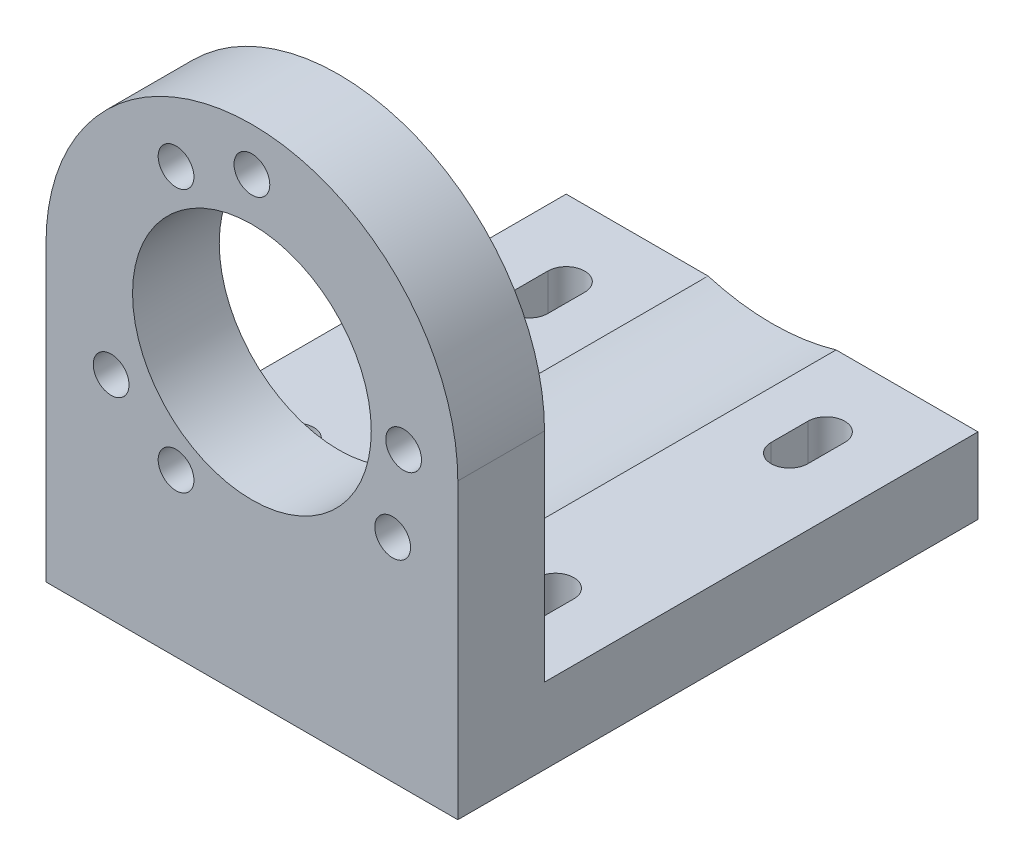
from build123d import *

# Parameters (mm, degrees)
SKETCH1_R                = 11.013886191
BOSS_EXTRUDE1_DEPTH      = 8
BOSS_EXTRUDE2_DEPTH      = 5
BOSS_EXTRUDE2_DEPTH_BACK = 2
SKETCH2_W                = 38
SKETCH2_H                = 48
CUT_EXTRUDE1_DEPTH       = 51
CUT_EXTRUDE2_DEPTH       = 51


with BuildPart() as part:
    # Sketch1 → Boss-Extrude1 (new body)
    with BuildSketch(Plane.XY):
        with BuildLine():
            Line((0, -22.07294906), (-19, -22.07294906))
            Line((-19, -22.07294906), (-19, 0))
            ThreePointArc((-19, 0), (0, 19), (19, 0))
            Line((19, 0), (19, -22.07294906))
            Line((19, -22.07294906), (0, -22.07294906))
        make_face()
        Circle(SKETCH1_R, mode=Mode.SUBTRACT)
        with BuildLine():
            ThreePointArc((-11.340381057, -7.5), (-12.990381057, -5.85), (-14.640381057, -7.5))
            ThreePointArc((-14.640381057, -7.5), (-12.990381057, -9.15), (-11.340381057, -7.5))
        make_face(mode=Mode.SUBTRACT)
        with BuildLine():
            ThreePointArc((-5.35, -12.124355653), (-7, -10.474355653), (-8.65, -12.124355653))
            ThreePointArc((-8.65, -12.124355653), (-7, -13.774355653), (-5.35, -12.124355653))
        make_face(mode=Mode.SUBTRACT)
        with BuildLine():
            ThreePointArc((11.340381057, -7.5), (12.990381057, -9.15), (14.640381057, -7.5))
            ThreePointArc((14.640381057, -7.5), (12.990381057, -5.85), (11.340381057, -7.5))
        make_face(mode=Mode.SUBTRACT)
        with BuildLine():
            ThreePointArc((15.65, 0), (14, 1.65), (12.35, 0))
            ThreePointArc((12.35, 0), (14, -1.65), (15.65, 0))
        make_face(mode=Mode.SUBTRACT)
        with BuildLine():
            ThreePointArc((-1.65, 15), (0, 13.35), (1.65, 15))
            ThreePointArc((1.65, 15), (0, 16.65), (-1.65, 15))
        make_face(mode=Mode.SUBTRACT)
        with BuildLine():
            ThreePointArc((-5.35, 12.124355653), (-7, 13.774355653), (-8.65, 12.124355653))
            ThreePointArc((-8.65, 12.124355653), (-7, 10.474355653), (-5.35, 12.124355653))
        make_face(mode=Mode.SUBTRACT)
    extrude(amount=BOSS_EXTRUDE1_DEPTH)

    # Sketch2 → Boss-Extrude2 (add, two sides: drawn at the far end of the back side and taken through both)
    with BuildSketch(Plane.XZ.offset(22.07294906).offset(-BOSS_EXTRUDE2_DEPTH_BACK)):
        with Locations((0, -16)):
            Rectangle(SKETCH2_W, SKETCH2_H)
    extrude(amount=BOSS_EXTRUDE2_DEPTH + BOSS_EXTRUDE2_DEPTH_BACK)

    # Sketch3 → Cut-Extrude1 (cut)
    with BuildSketch(Plane(origin=(0, 0, 0), x_dir=(-1, 0, 0), z_dir=(0, 0, -1))):
        with BuildLine():
            Line((5.904398983, -20.07294906), (-5.904398983, -20.07294906))
            ThreePointArc((-5.904398983, -20.07294906), (0, -20.923317407), (5.904398983, -20.07294906))
        make_face()
    extrude(amount=CUT_EXTRUDE1_DEPTH, mode=Mode.SUBTRACT)

    # Sketch4 → Cut-Extrude2 (cut)
    with BuildSketch(Plane(origin=(0, -20.07294906, 0), x_dir=(1, 0, 0), z_dir=(0, 1, 0))):
        with BuildLine():
            Line((-13.7, 8.006381215), (-13.7, 4.606381215))
            ThreePointArc((-13.7, 4.606381215), (-12, 2.906381215), (-10.3, 4.606381215))
            Line((-10.3, 4.606381215), (-10.3, 8.006381215))
            ThreePointArc((-10.3, 8.006381215), (-12, 9.706381215), (-13.7, 8.006381215))
        make_face()
        with BuildLine():
            Line((-13.7, 33.006381215), (-13.7, 29.606381215))
            ThreePointArc((-13.7, 29.606381215), (-12, 27.906381215), (-10.3, 29.606381215))
            Line((-10.3, 29.606381215), (-10.3, 33.006381215))
            ThreePointArc((-10.3, 33.006381215), (-12, 34.706381215), (-13.7, 33.006381215))
        make_face()
        with BuildLine():
            Line((13.7, 33.006381215), (13.7, 29.606381215))
            ThreePointArc((13.7, 29.606381215), (12, 27.906381215), (10.3, 29.606381215))
            Line((10.3, 29.606381215), (10.3, 33.006381215))
            ThreePointArc((10.3, 33.006381215), (12, 34.706381215), (13.7, 33.006381215))
        make_face()
        with BuildLine():
            Line((13.7, 8.006381215), (13.7, 4.606381215))
            ThreePointArc((13.7, 4.606381215), (12, 2.906381215), (10.3, 4.606381215))
            Line((10.3, 4.606381215), (10.3, 8.006381215))
            ThreePointArc((10.3, 8.006381215), (12, 9.706381215), (13.7, 8.006381215))
        make_face()
    extrude(amount=-CUT_EXTRUDE2_DEPTH, mode=Mode.SUBTRACT)


solid = part.part
